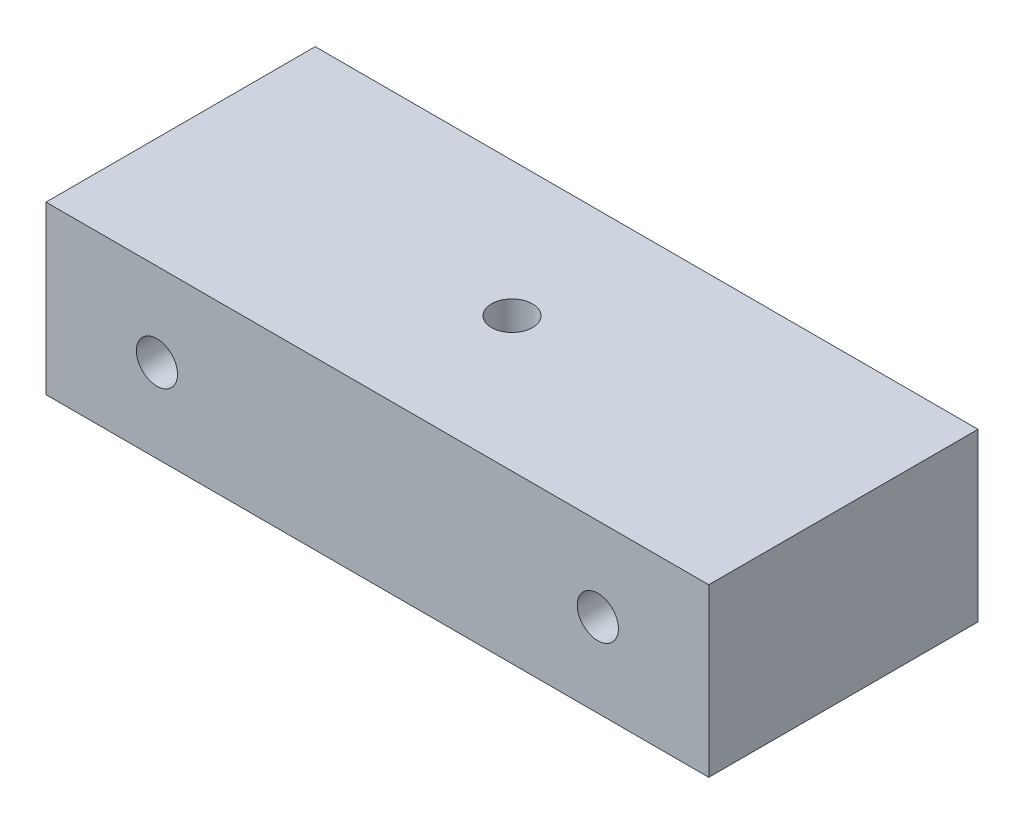
from build123d import *

# Parameters (mm, degrees)
BOSS_EXTRUDE1_START     = 0.05
BOSS_EXTRUDE1_DEPTH     = 18.32
CUT_EXTRUDE1_DEPTH      = 168.935502816
CUT_EXTRUDE1_DEPTH_BACK = 168.935502816
SKETCH2_R               = 1.4
SKETCH3_R               = 1.4
CUT_EXTRUDE2_DEPTH      = 65.399803221


with BuildPart() as part:
    # Sketch1 → Boss-Extrude1 (new body)
    with BuildSketch(Plane.XY.offset(BOSS_EXTRUDE1_START)):
        Polygon((60.67170061, -154.017379901), (60.67170061, -144.167379901), (15.57170061, -144.167379901), (15.57170061, -154.017379901), (15.57170061, -155.517379901), (60.67170061, -155.517379901), align=None)
    extrude(amount=BOSS_EXTRUDE1_DEPTH)

    # Sketch2 → Cut-Extrude1 (cut, two sides: drawn at the far end of the back side and taken through both)
    with BuildSketch(Plane.XY.offset(18.37).offset(-CUT_EXTRUDE1_DEPTH_BACK)):
        with Locations((23.12170061, -149.842379901)):
            Circle(SKETCH2_R)
        with Locations((53.12170061, -149.842379901)):
            Circle(SKETCH2_R)
    extrude(amount=CUT_EXTRUDE1_DEPTH + CUT_EXTRUDE1_DEPTH_BACK, mode=Mode.SUBTRACT)

    # Sketch3 → Cut-Extrude2 (cut, through all)
    with BuildSketch(Plane(origin=(0, -144.167379901, 0), x_dir=(1, 0, 0), z_dir=(0, 1, 0))):
        with Locations(Location((38.12170061, -9.21, 0), (0, 0, 270))):
            Circle(SKETCH3_R)
    extrude(amount=-CUT_EXTRUDE2_DEPTH, mode=Mode.SUBTRACT)


solid = part.part
